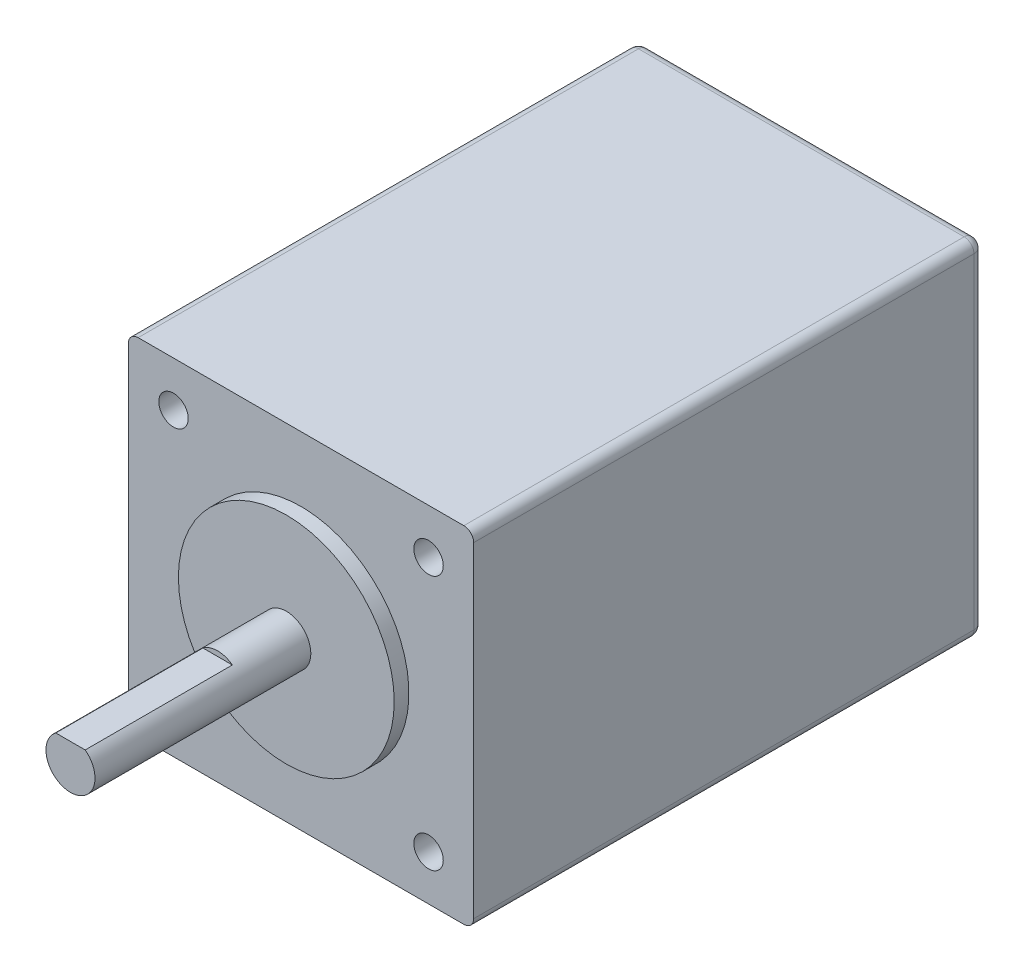
from build123d import *

# Parameters (mm, degrees)
SKETCH1_W           = 35.2
SKETCH1_H           = 35.2
BOSS_EXTRUDE1_DEPTH = 52
SKETCH2_R           = 11
BOSS_EXTRUDE2_DEPTH = 1.5
SKETCH3_R           = 2.5
BOSS_EXTRUDE3_DEPTH = 22
SKETCH4_W           = 15
SKETCH4_H           = 0.5
CUT_EXTRUDE1_DEPTH  = 5
SKETCH5_R           = 1.5
CUT_EXTRUDE2_DEPTH  = 4.5
FILLET1_R           = 1


with BuildPart() as part:
    # Sketch1 → Boss-Extrude1 (new body)
    with BuildSketch(Plane.XY):
        Rectangle(SKETCH1_W, SKETCH1_H)
    extrude(amount=BOSS_EXTRUDE1_DEPTH)

    # Sketch2 → Boss-Extrude2 (add)
    with BuildSketch(Plane.XY.offset(52)):
        with Locations(Location((0, 0, 0), (0, 0, 180))):
            Circle(SKETCH2_R)
    extrude(amount=BOSS_EXTRUDE2_DEPTH)

    # Sketch3 → Boss-Extrude3 (add)
    with BuildSketch(Plane.XY.offset(53.5)):
        Circle(SKETCH3_R)
    extrude(amount=BOSS_EXTRUDE3_DEPTH)

    # Sketch4 → Cut-Extrude1 (cut, symmetric)
    with BuildSketch(Plane(origin=(0, 0, 0), x_dir=(0, 0, -1), z_dir=(1, 0, 0))):
        with Locations((-68, 2.25)):
            Rectangle(SKETCH4_W, SKETCH4_H)
    extrude(amount=CUT_EXTRUDE1_DEPTH, both=True, mode=Mode.SUBTRACT)

    # Sketch5 → Cut-Extrude2 (cut)
    with BuildSketch(Plane.XY.offset(52)):
        with Locations((-13, 13)):
            Circle(SKETCH5_R)
        with Locations((13, 13)):
            Circle(SKETCH5_R)
        with Locations((13, -13)):
            Circle(SKETCH5_R)
        with Locations((-13, -13)):
            Circle(SKETCH5_R)
    extrude(amount=-CUT_EXTRUDE2_DEPTH, mode=Mode.SUBTRACT)

    # Fillet1
    fillet1_edges = [part.edges().sort_by_distance(p)[0] for p in [
        (0, -17.6, 0),
        (-17.6, 0, 0),
        (0, 17.6, 0),
        (17.6, 0, 0),
        (17.6, -17.6, 26),
        (-17.6, -17.6, 26),
        (-17.6, 17.6, 26),
        (17.6, 17.6, 26),
    ]]
    fillet(fillet1_edges, radius=FILLET1_R)


solid = part.part
